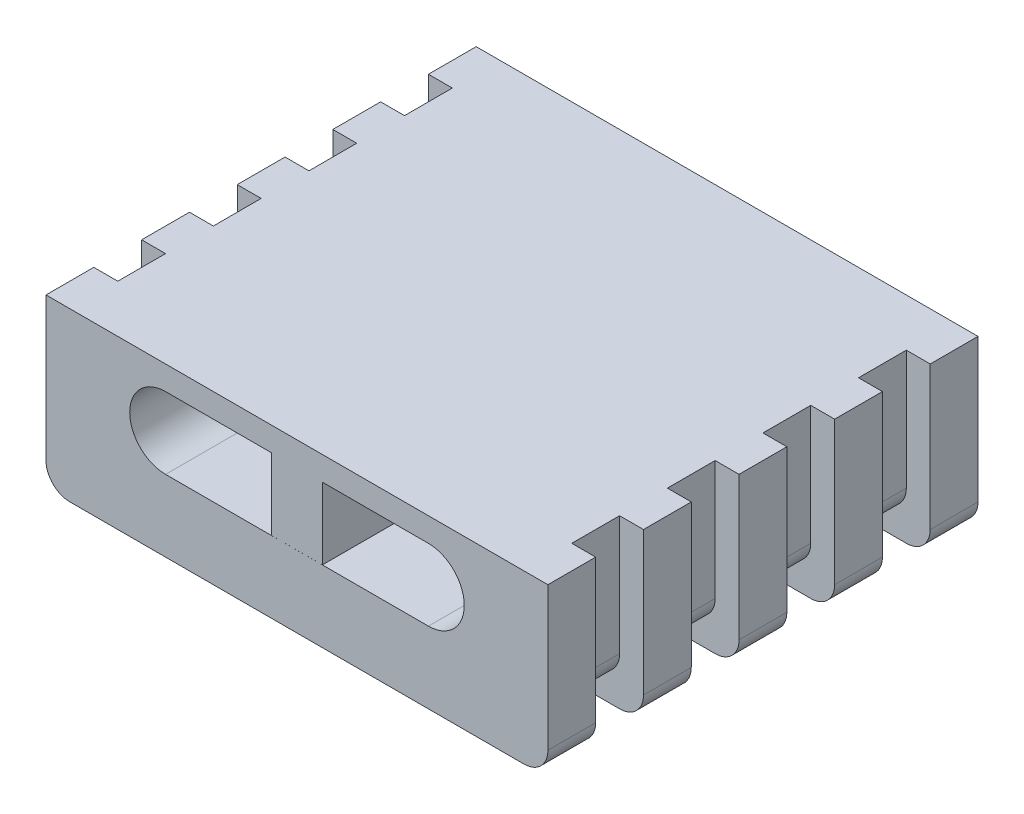
from build123d import *

# Parameters (mm, degrees)
SKETCH2_W            = 21
SKETCH2_H            = 7
BOSS_EXTRUDE1_DEPTH  = 2
SKETCH3_W            = 19
SKETCH3_H            = 6
BOSS_EXTRUDE2_DEPTH  = 2
SKETCH4_W            = 21
SKETCH4_H            = 7
BOSS_EXTRUDE3_DEPTH  = 2
SKETCH5_W            = 19
SKETCH5_H            = 6
BOSS_EXTRUDE4_DEPTH  = 2
SKETCH6_W            = 21
SKETCH6_H            = 7
BOSS_EXTRUDE5_DEPTH  = 2
SKETCH7_W            = 19
SKETCH7_H            = 6
BOSS_EXTRUDE6_DEPTH  = 2
SKETCH8_W            = 21
SKETCH8_H            = 7
BOSS_EXTRUDE7_DEPTH  = 2
FILLET1_R            = 1
CUT_EXTRUDE2_DEPTH   = 14
SKETCH13_W           = 2.12863245
SKETCH13_H           = 3.140125133
BOSS_EXTRUDE9_DEPTH  = 14
SKETCH14_W           = 19
SKETCH14_H           = 6
BOSS_EXTRUDE10_DEPTH = 2
SKETCH15_W           = 21.003804152
SKETCH15_H           = 7.001896417
BOSS_EXTRUDE11_DEPTH = 2
FILLET2_R            = 1
CUT_EXTRUDE4_DEPTH   = 4
SKETCH17_W           = 2.12863245
SKETCH17_H           = 2.998103583
BOSS_EXTRUDE12_DEPTH = 4


with BuildPart() as part:
    # Sketch2 → Boss-Extrude1 (new body)
    with BuildSketch(Plane.XY):
        Rectangle(SKETCH2_W, SKETCH2_H)
    extrude(amount=BOSS_EXTRUDE1_DEPTH)

    # Sketch3 → Boss-Extrude2 (add)
    with BuildSketch(Plane.XY.offset(2)):
        with Locations((0, 0.5)):
            Rectangle(SKETCH3_W, SKETCH3_H)
    extrude(amount=BOSS_EXTRUDE2_DEPTH)

    # Sketch4 → Boss-Extrude3 (add)
    with BuildSketch(Plane.XY.offset(4)):
        Rectangle(SKETCH4_W, SKETCH4_H)
    extrude(amount=BOSS_EXTRUDE3_DEPTH)

    # Sketch5 → Boss-Extrude4 (add)
    with BuildSketch(Plane.XY.offset(6)):
        with Locations((0, 0.5)):
            Rectangle(SKETCH5_W, SKETCH5_H)
    extrude(amount=BOSS_EXTRUDE4_DEPTH)

    # Sketch6 → Boss-Extrude5 (add)
    with BuildSketch(Plane.XY.offset(8)):
        Rectangle(SKETCH6_W, SKETCH6_H)
    extrude(amount=BOSS_EXTRUDE5_DEPTH)

    # Sketch7 → Boss-Extrude6 (add)
    with BuildSketch(Plane.XY.offset(10)):
        with Locations((0, 0.5)):
            Rectangle(SKETCH7_W, SKETCH7_H)
    extrude(amount=BOSS_EXTRUDE6_DEPTH)

    # Sketch8 → Boss-Extrude7 (add)
    with BuildSketch(Plane.XY.offset(12)):
        Rectangle(SKETCH8_W, SKETCH8_H)
    extrude(amount=BOSS_EXTRUDE7_DEPTH)

    # Fillet1
    fillet1_edges = [part.edges().sort_by_distance(p)[0] for p in [
        (-9.5, -2.5, 3),
        (9.5, -2.5, 3),
        (-10.5, -3.5, 5),
        (10.5, -3.5, 5),
        (-9.5, -2.5, 7),
        (9.5, -2.5, 7),
        (10.5, -3.5, 9),
        (-10.5, -3.5, 9),
        (-9.5, -2.5, 11),
        (9.5, -2.5, 11),
        (10.5, -3.5, 1),
        (-10.5, -3.5, 13),
        (10.5, -3.5, 13),
        (-10.5, -3.5, 1),
    ]]
    fillet(fillet1_edges, radius=FILLET1_R)

    # Sketch12 → Cut-Extrude2 (cut)
    with BuildSketch(Plane(origin=(0, 0, 0), x_dir=(-1, 0, 0), z_dir=(0, 0, -1))):
        with BuildLine():
            Line((-5.5, 2.5), (5.5, 2.5))
            ThreePointArc((5.5, 2.5), (7, 1), (5.5, -0.5))
            Line((5.5, -0.5), (-5.5, -0.5))
            ThreePointArc((-5.5, -0.5), (-7, 1), (-5.5, 2.5))
        make_face()
    extrude(amount=-CUT_EXTRUDE2_DEPTH, mode=Mode.SUBTRACT)

    # Sketch13 → Boss-Extrude9 (add)
    with BuildSketch(Plane(origin=(0, 0, 0), x_dir=(-1, 0, 0), z_dir=(0, 0, -1))):
        with Locations((0, 1.070062567)):
            Rectangle(SKETCH13_W, SKETCH13_H)
    extrude(amount=-BOSS_EXTRUDE9_DEPTH)

    # Sketch14 → Boss-Extrude10 (add)
    with BuildSketch(Plane.XY.offset(14)):
        with Locations((0, 0.5)):
            Rectangle(SKETCH14_W, SKETCH14_H)
    extrude(amount=BOSS_EXTRUDE10_DEPTH)

    # Sketch15 → Boss-Extrude11 (add)
    with BuildSketch(Plane.XY.offset(16)):
        with Locations((-0.001902076, -0.000948209)):
            Rectangle(SKETCH15_W, SKETCH15_H)
    extrude(amount=BOSS_EXTRUDE11_DEPTH)

    # Fillet2
    fillet2_edges = [part.edges().sort_by_distance(p)[0] for p in [
        (9.5, -2.5, 15),
        (-9.5, -2.5, 15),
        (10.5, -3.501896417, 17),
        (-10.503804152, -3.501896417, 17),
    ]]
    fillet(fillet2_edges, radius=FILLET2_R)

    # Sketch16 → Cut-Extrude4 (cut)
    with BuildSketch(Plane.XY.offset(18)):
        with BuildLine():
            Line((5.5, -0.501896417), (-5.5, -0.501896417))
            ThreePointArc((-5.5, -0.501896417), (-7, 0.998103583), (-5.5, 2.498103583))
            Line((-5.5, 2.498103583), (5.5, 2.498103583))
            ThreePointArc((5.5, 2.498103583), (7, 0.998103583), (5.5, -0.501896417))
        make_face()
    extrude(amount=-CUT_EXTRUDE4_DEPTH, mode=Mode.SUBTRACT)

    # Sketch17 → Boss-Extrude12 (add)
    with BuildSketch(Plane.XY.offset(18)):
        with Locations((0, 0.999051792)):
            Rectangle(SKETCH17_W, SKETCH17_H)
    extrude(amount=-BOSS_EXTRUDE12_DEPTH)


solid = part.part
